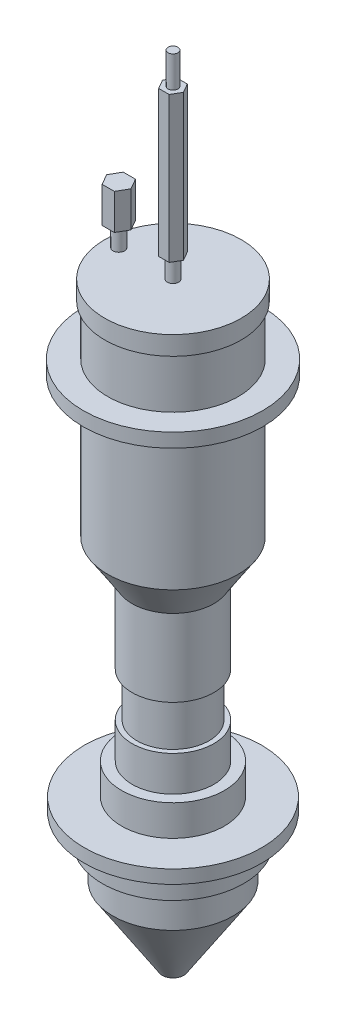
from build123d import *

# Parameters (mm, degrees)
SKETCH_2_R      = 4
EXTRUDE_1_DEPTH = 15
EXTRUDE_2_DEPTH = 102
SKETCH_4_R      = 3.42
EXTRUDE_3_DEPTH = 22
EXTRUDE_4_DEPTH = 25


with BuildPart() as part:
    # 草图1 → 旋转1 (revolve)
    with BuildSketch(Plane.XY, mode=Mode.PRIVATE) as revolve_1_sk:
        Polygon((0, 0), (7.5, 0), (42.09, 53.35), (42.09, 76.73), (49.525, 76.73), (49.525, 95.5), (62.215, 95.5), (62.215, 104.91), (36.02, 104.91), (36.02, 126.55), (28.645, 126.55), (28.645, 151.31), (25.25, 151.31), (25.25, 182.28), (28.645, 182.28), (28.645, 236.27), (45.765, 262.67), (45.765, 360.73), (62.835, 360.73), (62.835, 370.54), (45.765, 370.54), (45.765, 405.93), (47.82, 405.93), (47.82, 419.14), (0, 419.14), align=None)
    revolve(revolve_1_sk.sketch.rotate(Axis((0, 0, 0), (0, 1, 0)), 90), axis=Axis((0, 0, 0), (0, 1, 0)))

    # 草图2 → 凸台-拉伸1 (add)
    with BuildSketch(Plane(origin=(0, 419.14, 0), x_dir=(1, 0, 0), z_dir=(0, 1, 0))):
        with Locations(Location((0, 0, 0), (0, 0, 270))):
            Circle(SKETCH_2_R)
        with Locations(Location((-38, 0, 0), (0, 0, 270))):
            Circle(SKETCH_2_R)
    extrude(amount=EXTRUDE_1_DEPTH)

    # 草图3 → 凸台-拉伸2 (add)
    with BuildSketch(Plane(origin=(0, 434.14, 0), x_dir=(1, 0, 0), z_dir=(0, 1, 0))):
        Polygon((3.674834463, -6.365), (7.349668927, 0), (3.674834463, 6.365), (-3.674834463, 6.365), (-7.349668927, 0), (-3.674834463, -6.365), align=None)
    extrude(amount=EXTRUDE_2_DEPTH)

    # 草图4 → 凸台-拉伸3 (add)
    with BuildSketch(Plane(origin=(0, 536.14, 0), x_dir=(1, 0, 0), z_dir=(0, 1, 0))):
        with Locations(Location((0, 0, 0), (0, 0, 270))):
            Circle(SKETCH_4_R)
    extrude(amount=EXTRUDE_3_DEPTH)

    # 草图5 → 凸台-拉伸4 (add)
    with BuildSketch(Plane(origin=(0, 434.14, 0), x_dir=(1, 0, 0), z_dir=(0, 1, 0))):
        Polygon((-29.449442513, 0), (-33.724721257, 7.405), (-42.275278743, 7.405), (-46.550557487, 0), (-42.275278743, -7.405), (-33.724721257, -7.405), align=None)
    extrude(amount=EXTRUDE_4_DEPTH)


solid = part.part
